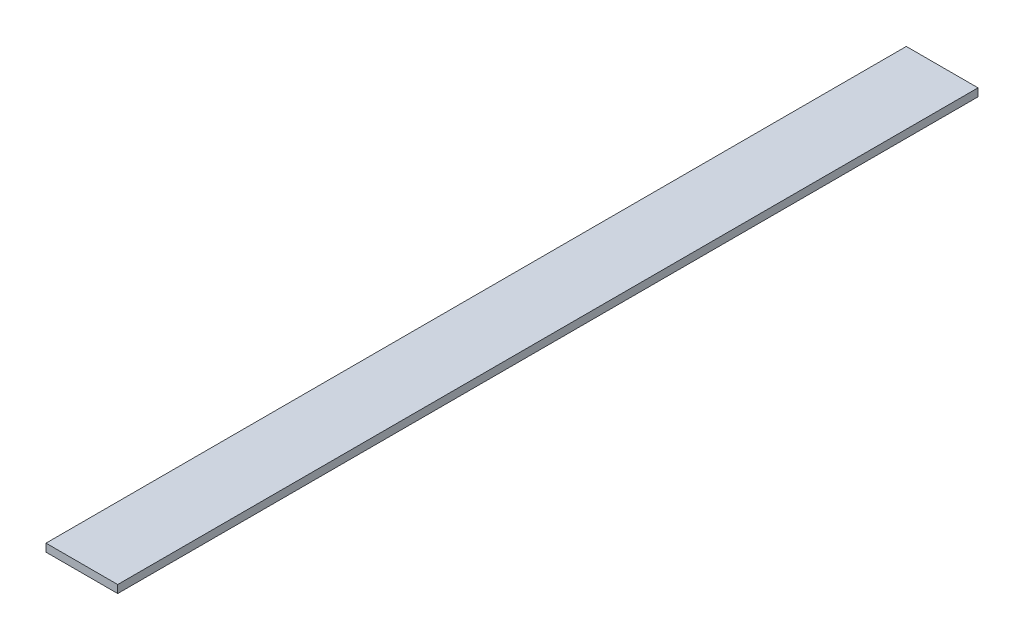
from build123d import *

# Parameters (mm, degrees)
SKETCH3_W           = 101.6
SKETCH3_H           = 11.1125
BOSS_EXTRUDE1_DEPTH = 609.6


with BuildPart() as part:
    # Sketch3 → Boss-Extrude1 (new, symmetric)
    with BuildSketch(Plane.XY):
        Rectangle(SKETCH3_W, SKETCH3_H)
    extrude(amount=BOSS_EXTRUDE1_DEPTH, both=True)


solid = part.part
